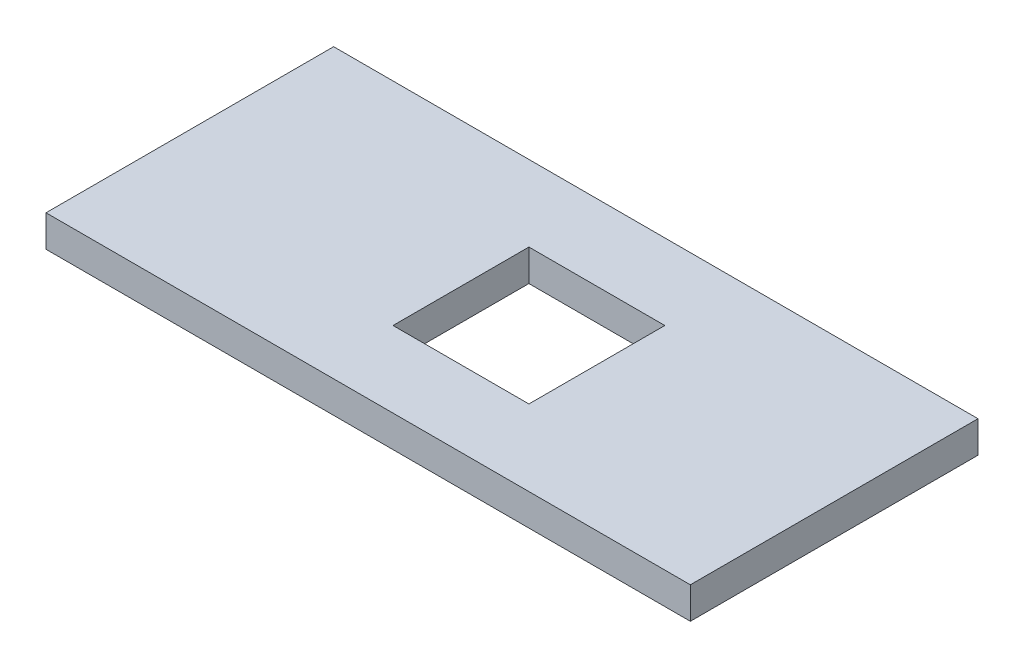
from build123d import *

# Parameters (mm, degrees)
SKETCH1_W           = 284.48
SKETCH1_H           = 127
BOSS_EXTRUDE1_DEPTH = 13.97
SKETCH2_W           = 60
SKETCH2_H           = 60
CUT_EXTRUDE1_DEPTH  = 157.395743229


with BuildPart() as part:
    # Sketch1 → Boss-Extrude1 (new body)
    with BuildSketch(Plane(origin=(0, 0, 0), x_dir=(1, 0, 0), z_dir=(0, 1, 0))):
        Rectangle(SKETCH1_W, SKETCH1_H)
    extrude(amount=BOSS_EXTRUDE1_DEPTH)

    # Sketch2 → Cut-Extrude1 (cut, through all)
    with BuildSketch(Plane(origin=(0, 13.97, 0), x_dir=(1, 0, 0), z_dir=(0, 1, 0))):
        with Locations((7.4676, 0)):
            Rectangle(SKETCH2_W, SKETCH2_H)
    extrude(amount=-CUT_EXTRUDE1_DEPTH, mode=Mode.SUBTRACT)


solid = part.part
